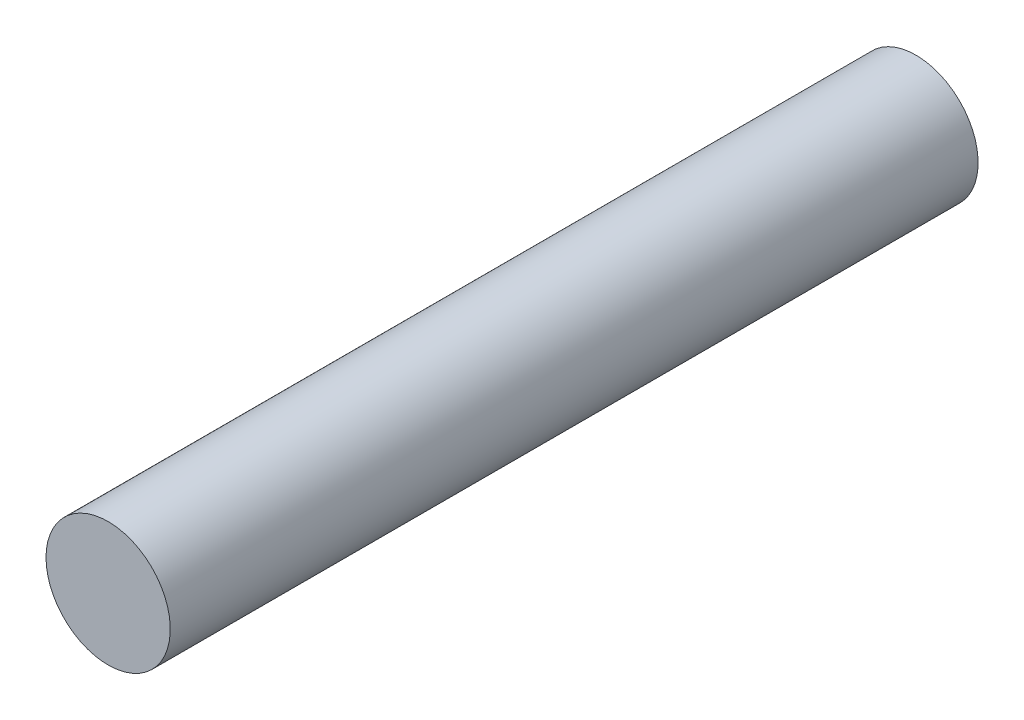
from build123d import *

# Parameters (mm, degrees)
CROQUIS1_R              = 2
SALIENTE_EXTRUIR1_DEPTH = 26


with BuildPart() as part:
    # Croquis1 → Saliente-Extruir1 (new body)
    with BuildSketch(Plane.XY):
        with Locations(Location((0, 0, 0), (0, 0, 180))):
            Circle(CROQUIS1_R)
    extrude(amount=SALIENTE_EXTRUIR1_DEPTH)


solid = part.part
